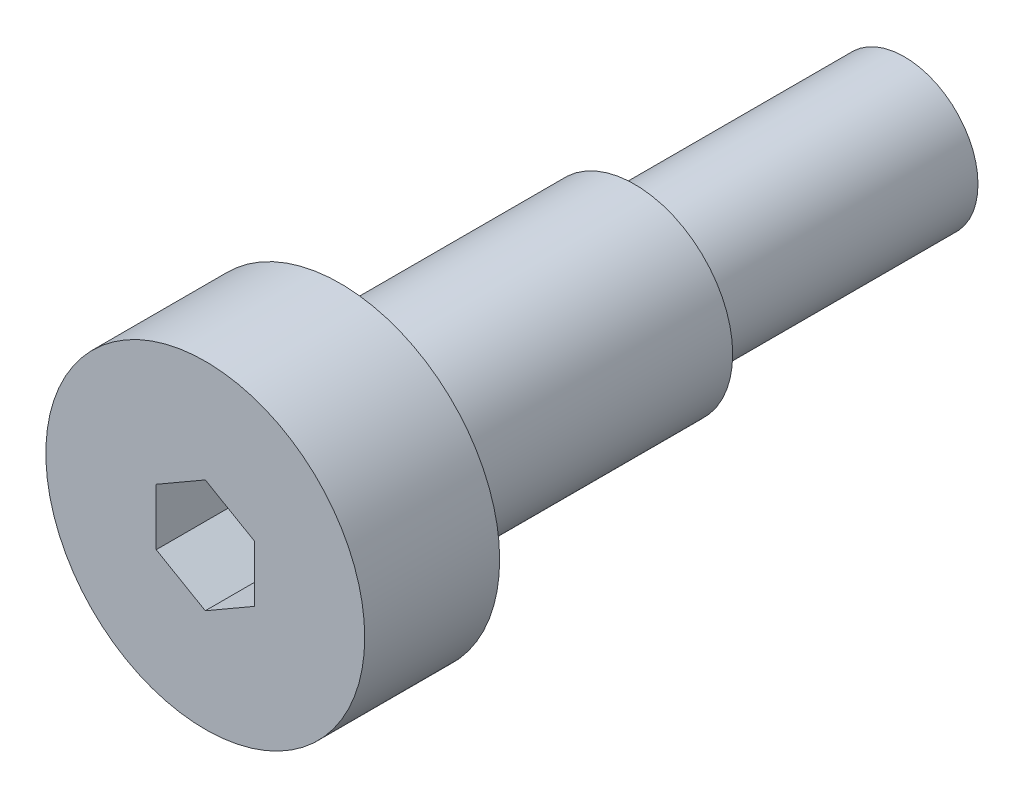
from build123d import *

# Parameters (mm, degrees)
SHOULDER_START    = 7
PROFILE_1_R       = 4
SHOULDER_DEPTH    = 12
M6_THREAD_START   = -4
PROFILE_2_R       = 3
M6_THREAD_DEPTH   = 11
SOCKET_HEAD_START = 19
PROFILE_3_R       = 6.5
SOCKET_HEAD_DEPTH = 5.5


with BuildPart() as part:
    # Profile_1 → Shoulder (new body)
    with BuildSketch(Plane.XY.offset(SHOULDER_START)):
        Circle(PROFILE_1_R)
    extrude(amount=SHOULDER_DEPTH)

    # Profile_2 → M6_thread (add)
    with BuildSketch(Plane.XY.offset(M6_THREAD_START)):
        Circle(PROFILE_2_R)
    extrude(amount=M6_THREAD_DEPTH)

    # Profile_3 → Socket_head (add)
    with BuildSketch(Plane.XY.offset(SOCKET_HEAD_START)):
        Circle(PROFILE_3_R)
        Polygon((2, 1.154700538), (0, 2.309401077), (-2, 1.154700538), (-2, -1.154700538), (0, -2.309401077), (2, -1.154700538), align=None, mode=Mode.SUBTRACT)
    extrude(amount=SOCKET_HEAD_DEPTH)


solid = part.part
